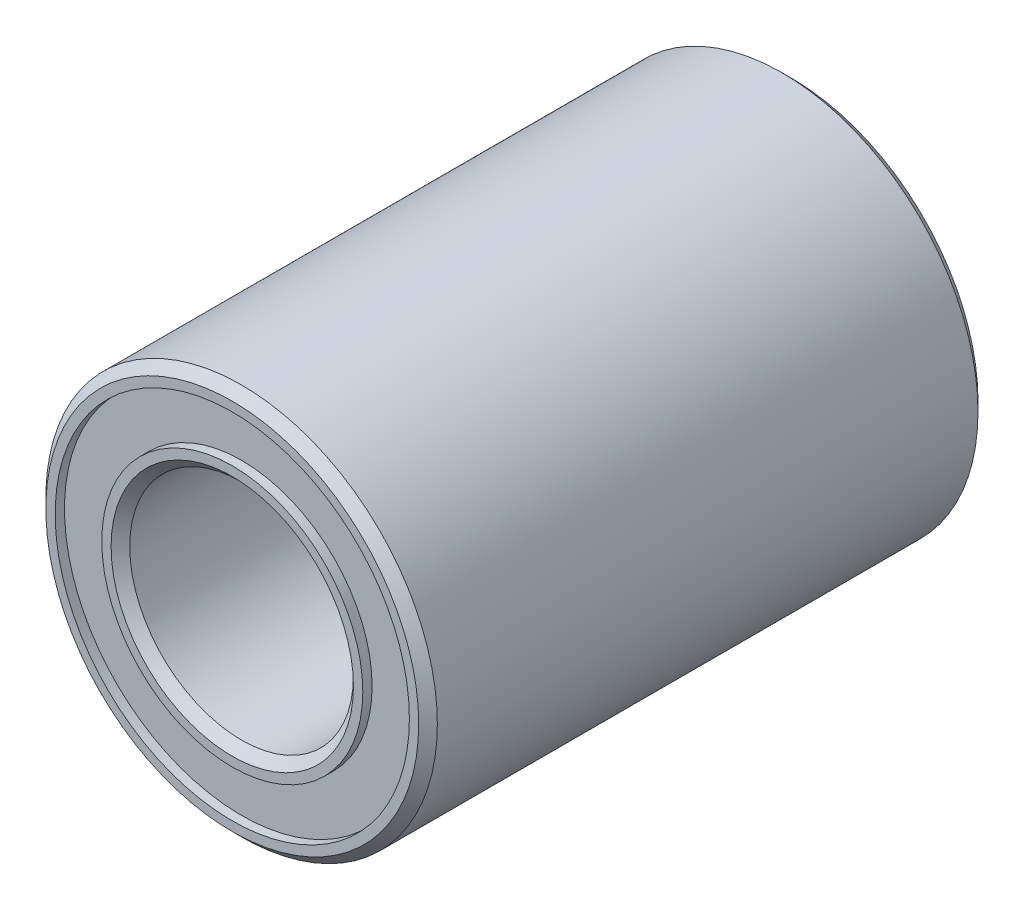
from build123d import *

# Parameters (mm, degrees)
SKETCH1_R           = 10.5
SKETCH1_R_2         = 6
BOSS_EXTRUDE1_DEPTH = 30
SKETCH2_R           = 9.5
SKETCH2_R_2         = 7
CUT_EXTRUDE1_DEPTH  = 0.5
CUT_EXTRUDE2_START  = -0.5
SKETCH3_R           = 9.5
SKETCH3_R_2         = 7
CUT_EXTRUDE2_DEPTH  = 0.5
CHAMFER1_SIZE       = 0.5


with BuildPart() as part:
    # Sketch1 → Boss-Extrude1 (new body)
    with BuildSketch(Plane.XY):
        Circle(SKETCH1_R)
        Circle(SKETCH1_R_2, mode=Mode.SUBTRACT)
    extrude(amount=BOSS_EXTRUDE1_DEPTH)

    # Sketch2 → Cut-Extrude1 (cut)
    with BuildSketch(Plane.XY.offset(30)):
        Circle(SKETCH2_R)
        Circle(SKETCH2_R_2, mode=Mode.SUBTRACT)
    extrude(amount=-CUT_EXTRUDE1_DEPTH, mode=Mode.SUBTRACT)

    # Sketch3 → Cut-Extrude2 (cut)
    with BuildSketch(Plane(origin=(0, 0, 0), x_dir=(-1, 0, 0), z_dir=(0, 0, -1)).offset(CUT_EXTRUDE2_START)):
        with Locations(Location((0, 0, 0), (0, 0, 180))):
            Circle(SKETCH3_R)
        with Locations(Location((0, 0, 0), (0, 0, 180))):
            Circle(SKETCH3_R_2, mode=Mode.SUBTRACT)
    extrude(amount=CUT_EXTRUDE2_DEPTH, mode=Mode.SUBTRACT)

    # Chamfer1
    chamfer1_edges = [part.edges().sort_by_distance(p)[0] for p in [
        (-10.5, 0, 0),
        (-10.5, 0, 30),
        (-6, 0, 0),
        (-6, 0, 30),
    ]]
    chamfer(chamfer1_edges, length=CHAMFER1_SIZE)


solid = part.part
